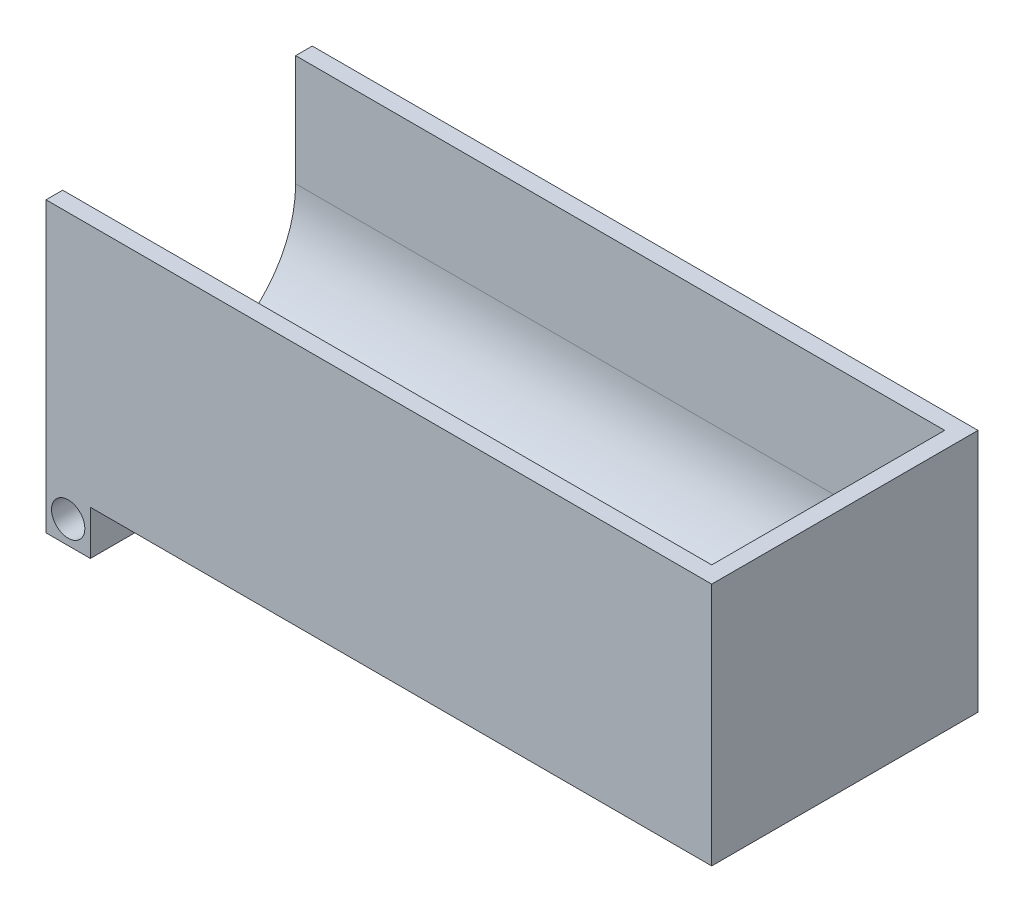
from build123d import *

# Parameters (mm, degrees)
BOSS_EXTRUDE1_DEPTH = 120
SKETCH2_W           = 8
SKETCH2_H           = 8
BOSS_EXTRUDE2_DEPTH = 48
CUT_EXTRUDE1_REACH  = 135.147
SKETCH3_R           = 3
SKETCH4_W           = 48
SKETCH4_H           = 24
BOSS_EXTRUDE3_DEPTH = 3
SKETCH5_W           = 4.321078357
SKETCH5_H           = 3
BOSS_EXTRUDE4_DEPTH = 5
SKETCH6_R           = 0.75
CUT_EXTRUDE2_DEPTH  = 129.842888822
BOSS_EXTRUDE5_DEPTH = 20


with BuildPart() as part:
    # Sketch1 → Boss-Extrude1 (new body)
    with BuildSketch(Plane(origin=(0, 0, 0), x_dir=(0, 0, -1), z_dir=(1, 0, 0))):
        with BuildLine():
            Line((21, 0), (24, 0))
            Line((24, 0), (24, -24))
            Line((24, -24), (-24, -24))
            Line((-24, -24), (-24, 0))
            Line((-24, 0), (-21, 0))
            ThreePointArc((-21, 0), (0, -21), (21, 0))
        make_face()
    extrude(amount=BOSS_EXTRUDE1_DEPTH)

    # Sketch2 → Boss-Extrude2 (add)
    with BuildSketch(Plane.XY.offset(24)):
        with Locations((4, -28)):
            Rectangle(SKETCH2_W, SKETCH2_H)
    extrude(amount=-BOSS_EXTRUDE2_DEPTH)

    # Sketch3 → Cut-Extrude1 (cut, up to next)
    with BuildSketch(Plane.XY.offset(24), mode=Mode.PRIVATE) as cut_extrude1_sk1:
        with Locations((4, -27.835840809)):
            Circle(SKETCH3_R)
    cut_extrude1_tool1 = extrude(cut_extrude1_sk1.sketch, amount=-CUT_EXTRUDE1_REACH, mode=Mode.PRIVATE) & part.part
    add(cut_extrude1_tool1.solids().sort_by_distance((4, -27.835841, 24))[0], mode=Mode.SUBTRACT)

    # Sketch4 → Boss-Extrude3 (add)
    with BuildSketch(Plane(origin=(120, 0, 0), x_dir=(0, 0, -1), z_dir=(1, 0, 0))):
        with Locations((0, -12)):
            Rectangle(SKETCH4_W, SKETCH4_H)
    extrude(amount=-BOSS_EXTRUDE3_DEPTH)

    # Sketch5 → Boss-Extrude4 (add)
    with BuildSketch(Plane.XZ.offset(24)):
        with Locations((17.531080317, -11.8)):
            Rectangle(SKETCH5_W, SKETCH5_H)
    extrude(amount=BOSS_EXTRUDE4_DEPTH)

    # Sketch6 → Cut-Extrude2 (cut, through all)
    with BuildSketch(Plane.XY.offset(-10.3)):
        with Locations((17.531080317, -26.5)):
            Circle(SKETCH6_R)
    extrude(amount=-CUT_EXTRUDE2_DEPTH, mode=Mode.SUBTRACT)

    # Sketch7 → Boss-Extrude5 (add)
    with BuildSketch(Plane(origin=(0, 0, 0), x_dir=(1, 0, 0), z_dir=(0, 1, 0))):
        Polygon((120, 24), (0, 24), (0, 21), (117, 21), (117, -21), (0, -21), (0, -24), (120, -24), align=None)
    extrude(amount=BOSS_EXTRUDE5_DEPTH)


solid = part.part
